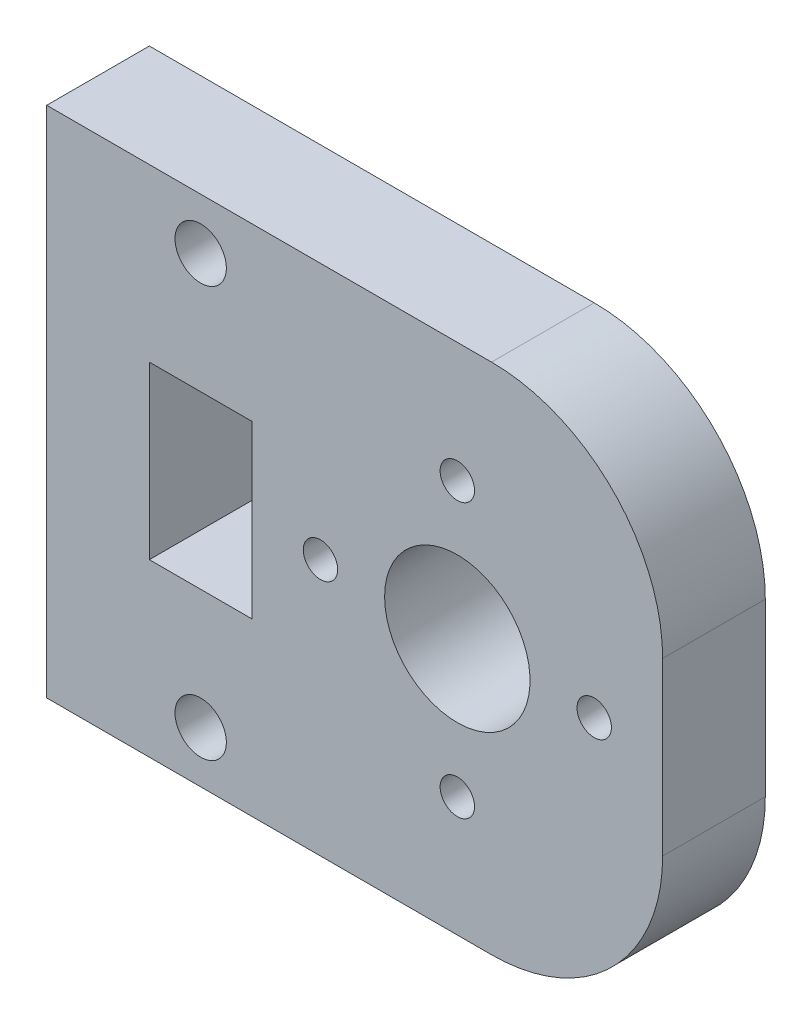
from build123d import *

# Parameters (mm, degrees)
ESQUISSE1_W             = 50
ESQUISSE1_H             = 30
BOSS_EXTRU_1_DEPTH      = 6
ESQUISSE4_W             = 5
ESQUISSE4_H             = 30
ENL_V_MAT_EXTRU_2_DEPTH = 6
ESQUISSE6_R             = 1.5
ENL_V_MAT_EXTRU_3_DEPTH = 6
ESQUISSE7_R             = 2.995
ENL_V_MAT_EXTRU_4_DEPTH = 3
ESQUISSE8_W             = 6
ESQUISSE8_H             = 10
ENL_V_MAT_EXTRU_5_DEPTH = 6
ESQUISSE10_R            = 1.005
ENL_V_MAT_EXTRU_6_DEPTH = 6
ESQUISSE11_R            = 4.25
ENL_V_MAT_EXTRU_7_DEPTH = 6
ESQUISSE12_W            = 9
ESQUISSE12_H            = 30
ENL_V_MAT_EXTRU_8_DEPTH = 6
CONG_1_R                = 10


with BuildPart() as part:
    # Esquisse1 → Boss.-Extru.1 (new body)
    with BuildSketch(Plane.XY):
        with Locations((0.584677419, -1.784274194)):
            Rectangle(ESQUISSE1_W, ESQUISSE1_H)
    extrude(amount=BOSS_EXTRU_1_DEPTH)

    # Esquisse4 → Enlèv. mat.-Extru.2 (cut)
    with BuildSketch(Plane.XY.offset(6)):
        with Locations((-21.915322581, -1.784274194)):
            Rectangle(ESQUISSE4_W, ESQUISSE4_H)
    extrude(amount=-ENL_V_MAT_EXTRU_2_DEPTH, mode=Mode.SUBTRACT)

    # Esquisse6 → Enlèv. mat.-Extru.3 (cut)
    with BuildSketch(Plane(origin=(0, 0, 0), x_dir=(-1, 0, 0), z_dir=(0, 0, -1))):
        with Locations((10.415322581, 10.215725806)):
            Circle(ESQUISSE6_R)
        with Locations((10.415322581, -13.784274194)):
            Circle(ESQUISSE6_R)
    extrude(amount=-ENL_V_MAT_EXTRU_3_DEPTH, mode=Mode.SUBTRACT)

    # Esquisse7 → Enlèv. mat.-Extru.4 (cut)
    with BuildSketch(Plane(origin=(0, 0, 0), x_dir=(-1, 0, 0), z_dir=(0, 0, -1))):
        with Locations((10.415322581, -13.784274194)):
            Circle(ESQUISSE7_R)
        with Locations((10.415322581, 10.215725806)):
            Circle(ESQUISSE7_R)
    extrude(amount=-ENL_V_MAT_EXTRU_4_DEPTH, mode=Mode.SUBTRACT)

    # Esquisse8 → Enlèv. mat.-Extru.5 (cut)
    with BuildSketch(Plane(origin=(0, 0, 0), x_dir=(-1, 0, 0), z_dir=(0, 0, -1))):
        with Locations((10.415322581, -1.784274194)):
            Rectangle(ESQUISSE8_W, ESQUISSE8_H)
    extrude(amount=-ENL_V_MAT_EXTRU_5_DEPTH, mode=Mode.SUBTRACT)

    # Esquisse10 → Enlèv. mat.-Extru.6 (cut)
    with BuildSketch(Plane(origin=(0, 0, 0), x_dir=(-1, 0, 0), z_dir=(0, 0, -1))):
        with Locations((-4.584677419, 6.215725806)):
            Circle(ESQUISSE10_R)
        with Locations((-12.584677419, -1.784274194)):
            Circle(ESQUISSE10_R)
        with Locations((3.415322581, -1.784274194)):
            Circle(ESQUISSE10_R)
        with Locations((-4.584677419, -9.784274194)):
            Circle(ESQUISSE10_R)
    extrude(amount=-ENL_V_MAT_EXTRU_6_DEPTH, mode=Mode.SUBTRACT)

    # Esquisse11 → Enlèv. mat.-Extru.7 (cut)
    with BuildSketch(Plane(origin=(0, 0, 0), x_dir=(-1, 0, 0), z_dir=(0, 0, -1))):
        with Locations((-4.584677419, -1.784274194)):
            Circle(ESQUISSE11_R)
    extrude(amount=-ENL_V_MAT_EXTRU_7_DEPTH, mode=Mode.SUBTRACT)

    # Esquisse12 → Enlèv. mat.-Extru.8 (cut)
    with BuildSketch(Plane(origin=(0, 0, 0), x_dir=(-1, 0, 0), z_dir=(0, 0, -1))):
        with Locations((-21.084677419, -1.784274194)):
            Rectangle(ESQUISSE12_W, ESQUISSE12_H)
    extrude(amount=-ENL_V_MAT_EXTRU_8_DEPTH, mode=Mode.SUBTRACT)

    # Congé1
    cong_1_edges = [part.edges().sort_by_distance(p)[0] for p in [
        (16.584677419, 13.215725806, 3),
        (16.584677419, -16.784274194, 3),
    ]]
    fillet(cong_1_edges, radius=CONG_1_R)


solid = part.part
